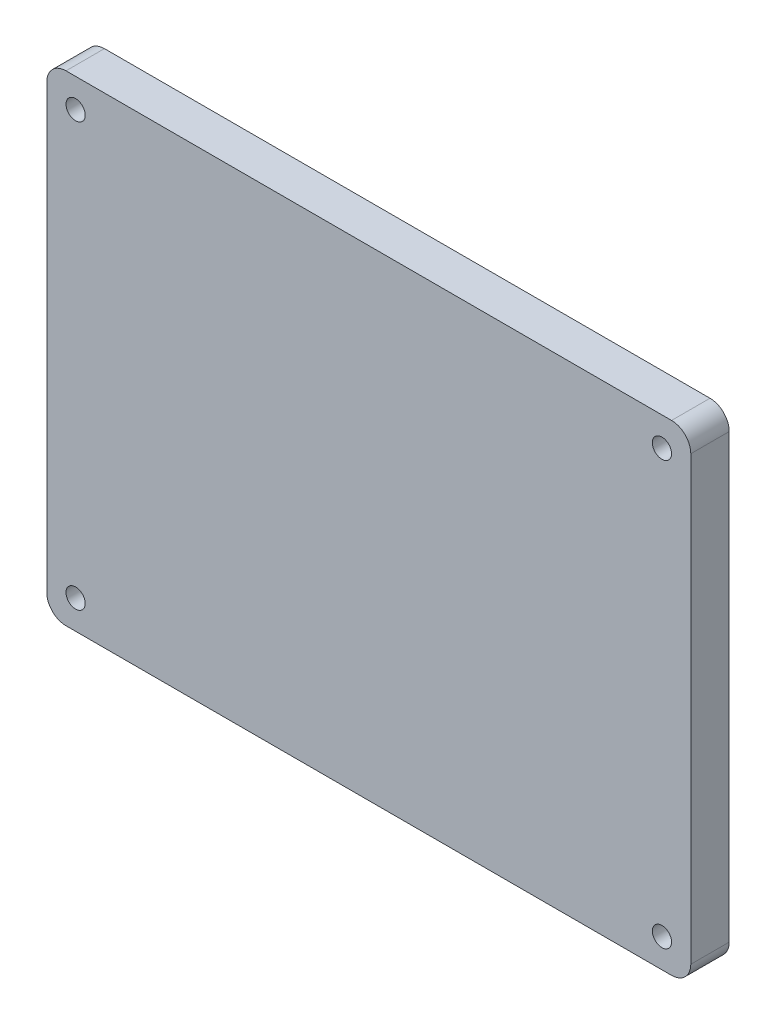
from build123d import *

# Parameters (mm, degrees)
ESQUISSE1_W                  = 335
ESQUISSE1_H                  = 250
BOSS_EXTRU_1_DEPTH           = 20
ENL_V_MAT_EXTRU_1_DEPTH      = 419.479390174
ENL_V_MAT_EXTRU_1_DEPTH_BACK = 419.479390174
ESQUISSE2_R                  = 5
CONG_1_R                     = 10


with BuildPart() as part:
    # Esquisse1 → Boss.-Extru.1 (new body)
    with BuildSketch(Plane.XY):
        with Locations((167.5, 125)):
            Rectangle(ESQUISSE1_W, ESQUISSE1_H)
    extrude(amount=BOSS_EXTRU_1_DEPTH)

    # Esquisse2 → Enlèv. mat.-Extru.1 (cut, two sides: drawn at the far end of the back side and taken through both)
    with BuildSketch(Plane.XY.offset(20).offset(-ENL_V_MAT_EXTRU_1_DEPTH_BACK)):
        with Locations((15, 15)):
            Circle(ESQUISSE2_R)
        with Locations(Location((320, 15, 0), (0, 0, 180))):
            Circle(ESQUISSE2_R)
        with Locations((320, 235)):
            Circle(ESQUISSE2_R)
        with Locations(Location((15, 235, 0), (0, 0, 180))):
            Circle(ESQUISSE2_R)
    extrude(amount=ENL_V_MAT_EXTRU_1_DEPTH + ENL_V_MAT_EXTRU_1_DEPTH_BACK, mode=Mode.SUBTRACT)

    # Congé1
    cong_1_edges = [part.edges().sort_by_distance(p)[0] for p in [
        (0, 250, 10),
        (335, 250, 10),
        (335, 0, 10),
        (0, 0, 10),
    ]]
    fillet(cong_1_edges, radius=CONG_1_R)


solid = part.part
